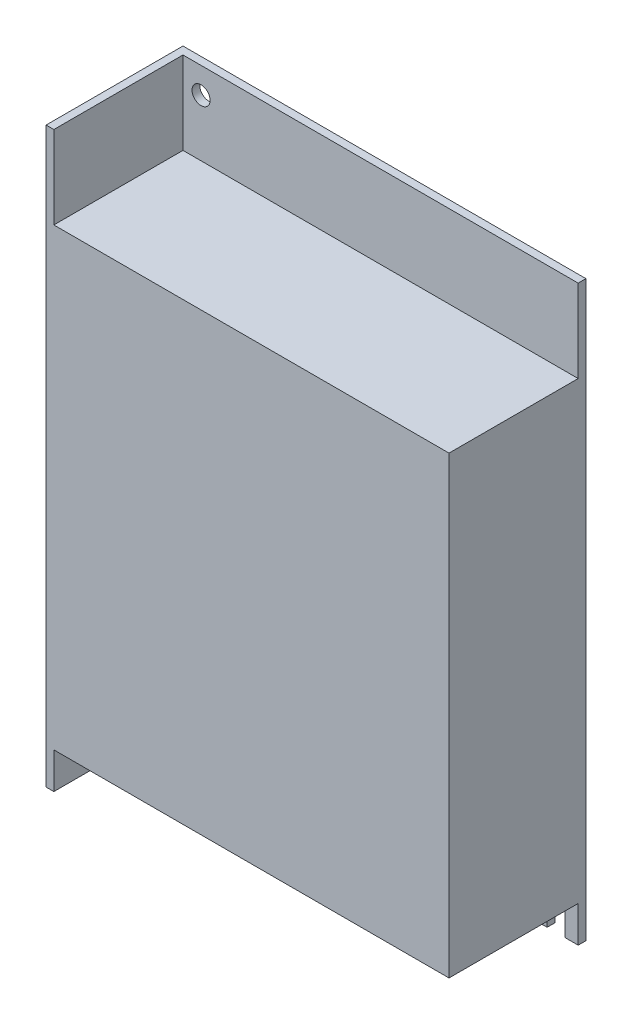
from build123d import *

# Parameters (mm, degrees)
ESQUISSE1_R        = 1.75
BOSS_EXTRU_1_DEPTH = 1.5
ESQUISSE2_W        = 76.5
ESQUISSE2_H        = 88
BOSS_EXTRU_2_DEPTH = 25


with BuildPart() as part:
    # Esquisse1 → Boss.-Extru.1 (new body)
    with BuildSketch(Plane.XY):
        with BuildLine():
            Line((72, 0), (72, 4.25))
            ThreePointArc((72, 4.25), (73.75, 6), (75.5, 4.25))
            Line((75.5, 4.25), (75.5, 0))
            Line((75.5, 0), (78, 0))
            Line((78, 0), (78, 111))
            Line((78, 111), (0, 111))
            Line((0, 111), (0, 0))
            Line((0, 0), (72, 0))
        make_face()
        with Locations((5, 106)):
            Circle(ESQUISSE1_R, mode=Mode.SUBTRACT)
    extrude(amount=BOSS_EXTRU_1_DEPTH)

    # Esquisse2 → Boss.-Extru.2 (add)
    with BuildSketch(Plane.XY.offset(1.5)):
        with Locations((39.75, 51)):
            Rectangle(ESQUISSE2_W, ESQUISSE2_H)
        Polygon((1.5, 111), (0, 111), (0, 0), (1.5, 0), (1.5, 7), (1.5, 95), align=None)
    extrude(amount=BOSS_EXTRU_2_DEPTH)


solid = part.part
